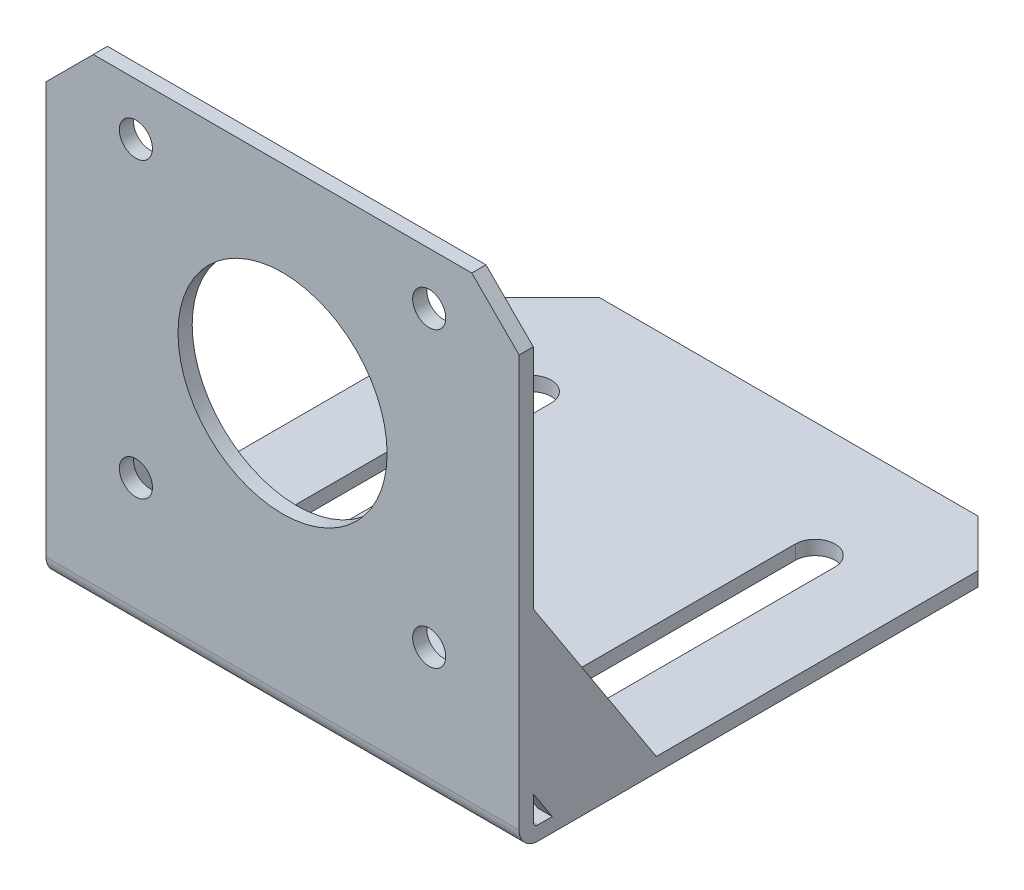
from build123d import *

# Parameters (mm, degrees)
LINEAR_AUSTRAGEN_D_NN1_DEPTH    = 50
SKIZZE2_R                       = 11.05
SKIZZE2_R_2                     = 1.75
SCHNITT_LINEAR_AUSTRAGEN1_DEPTH = 89.058219378
AUFSATZ_LINEAR_AUSTRAGEN1_DEPTH = 1.5
SCHNITT_LINEAR_AUSTRAGEN2_DEPTH = 89.109307113
FASE1_SIZE                      = 5


with BuildPart() as part:
    # Skizze1 → Linear-Austragen-Dünn1 (new body)
    with BuildSketch(Plane(origin=(0, 0, 0), x_dir=(0, 0, -1), z_dir=(1, 0, 0))):
        with BuildLine():
            Line((53.5, 0), (2, 0))
            ThreePointArc((2, 0), (0.585786438, 0.585786438), (0, 2))
            Line((0, 2), (0, 50.5))
            Line((0, 50.5), (1.5, 50.5))
            Line((1.5, 50.5), (1.5, 2))
            ThreePointArc((1.5, 2), (1.646446609, 1.646446609), (2, 1.5))
            Line((2, 1.5), (53.5, 1.5))
            Line((53.5, 1.5), (53.5, 0))
        make_face()
    extrude(amount=LINEAR_AUSTRAGEN_D_NN1_DEPTH)

    # Skizze2 → Schnitt-Linear austragen1 (cut, through all)
    with BuildSketch(Plane(origin=(0, 0, -1.5), x_dir=(-1, 0, 0), z_dir=(0, 0, -1))):
        with Locations((-25, 29.5)):
            Circle(SKIZZE2_R)
        with Locations((-40.5, 45)):
            Circle(SKIZZE2_R_2)
        with Locations((-9.5, 45)):
            Circle(SKIZZE2_R_2)
        with Locations((-9.5, 14)):
            Circle(SKIZZE2_R_2)
        with Locations((-40.5, 14)):
            Circle(SKIZZE2_R_2)
    extrude(amount=-SCHNITT_LINEAR_AUSTRAGEN1_DEPTH, mode=Mode.SUBTRACT)

    # Skizze3 → Aufsatz-Linear austragen1 (add)
    with BuildSketch(Plane(origin=(50, 0, 0), x_dir=(0, 0, -1), z_dir=(1, 0, 0))):
        Polygon((1.5, 21.5), (14.5, 1.5), (3.5, 1.5), (1.5, 4.576923077), align=None)
    aufsatz_linear_austragen1 = extrude(amount=-AUFSATZ_LINEAR_AUSTRAGEN1_DEPTH)

    # Spiegeln1: Aufsatz-Linear austragen1 across plane
    add(aufsatz_linear_austragen1.mirror(Plane(origin=(25, 0, 0), x_dir=(0, 0, 1), z_dir=(1, 0, 0))))

    # Skizze4 → Schnitt-Linear austragen2 (cut, through all)
    with BuildSketch(Plane(origin=(0, 1.5, 0), x_dir=(1, 0, 0), z_dir=(0, 1, 0))):
        with BuildLine():
            Line((7.9, 13.706666488), (7.9, 41.293333512))
            ThreePointArc((7.9, 41.293333512), (10, 43.393333512), (12.1, 41.293333512))
            Line((12.1, 41.293333512), (12.1, 13.706666488))
            ThreePointArc((12.1, 13.706666488), (10, 11.606666488), (7.9, 13.706666488))
        make_face()
        with BuildLine():
            Line((42.1, 13.706666488), (42.1, 41.293333512))
            ThreePointArc((42.1, 41.293333512), (40, 43.393333512), (37.9, 41.293333512))
            Line((37.9, 41.293333512), (37.9, 13.706666488))
            ThreePointArc((37.9, 13.706666488), (40, 11.606666488), (42.1, 13.706666488))
        make_face()
    extrude(amount=-SCHNITT_LINEAR_AUSTRAGEN2_DEPTH, mode=Mode.SUBTRACT)

    # Fase1
    fase1_edges = [part.edges().sort_by_distance(p)[0] for p in [
        (50, 50.5, -0.75),
        (50, 0.75, -53.5),
        (0, 50.5, -0.75),
        (0, 0.75, -53.5),
    ]]
    chamfer(fase1_edges, length=FASE1_SIZE)


solid = part.part
